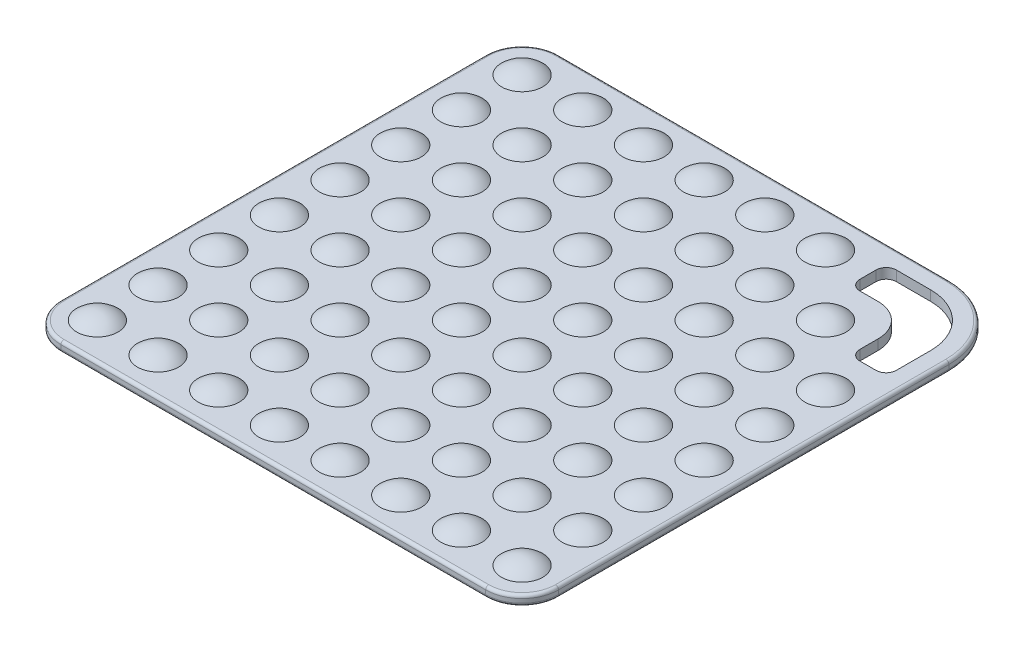
from build123d import *

# Parameters (mm, degrees)
BOSS_EXTRUDE1_DEPTH  = 5
LPATTERN1_COUNT      = 8
LPATTERN1_PITCH      = 30
LPATTERN1_COUNT_DIR2 = 8
LPATTERN1_PITCH_DIR2 = 30
FILLET1_R            = 1.5


with BuildPart() as part:
    # Sketch1 → Boss-Extrude1 (new body)
    with BuildSketch(Plane(origin=(0, 0, 0), x_dir=(1, 0, 0), z_dir=(0, 1, 0))):
        with BuildLine():
            Line((105, -123), (-105, -123))
            ThreePointArc((-105, -123), (-117.727922061, -117.727922061), (-123, -105))
            Line((-123, -105), (-123, 105))
            ThreePointArc((-123, 105), (-117.727922061, 117.727922061), (-105, 123))
            Line((-105, 123), (88, 123))
            ThreePointArc((88, 123), (112.748737342, 112.748737342), (123, 88))
            Line((123, 88), (123, -105))
            ThreePointArc((123, -105), (117.727922061, -117.727922061), (105, -123))
        make_face()
        with BuildLine():
            Line((71, 114), (88, 114))
            ThreePointArc((88, 114), (106.384776311, 106.384776311), (114, 88))
            Line((114, 88), (114, 71))
            ThreePointArc((114, 71), (112.535533906, 67.464466094), (109, 66))
            Line((109, 66), (101, 66))
            ThreePointArc((101, 66), (97.464466094, 67.464466094), (96, 71))
            Line((96, 71), (96, 80))
            ThreePointArc((96, 80), (91.313708499, 91.313708499), (80, 96))
            Line((80, 96), (71, 96))
            ThreePointArc((71, 96), (67.464466094, 97.464466094), (66, 101))
            Line((66, 101), (66, 109))
            ThreePointArc((66, 109), (67.464466094, 112.535533906), (71, 114))
        make_face(mode=Mode.SUBTRACT)
    extrude(amount=BOSS_EXTRUDE1_DEPTH)

    # Sketch4 → Revolve2 (revolve)
    with BuildSketch(Plane.XY.offset(105)):
        with BuildLine():
            Line((115.198039027, 5), (105, 5))
            Line((105, 5), (105, 9))
            ThreePointArc((105, 9), (110.477225575, 7.964240044), (115.198039027, 5))
        make_face()
    revolve2 = revolve(axis=Axis((105, 5, 105), (0, 1, 0)))

    # LPattern1: Revolve2 8 × 8, 3 skipped
    with Locations(*[(-j * LPATTERN1_PITCH_DIR2, 0, -i * LPATTERN1_PITCH) for i in range(LPATTERN1_COUNT) for j in range(LPATTERN1_COUNT_DIR2) if (i, j) not in ((0, 0), (6, 0), (7, 0), (7, 1))]):
        add(revolve2)

    # Fillet1
    fillet1_edges = [part.edges().sort_by_distance(p)[0] for p in [
        (0, 0, 123),
        (-117.727922061, 0, 117.727922061),
        (-123, 0, 0),
        (-117.727922061, 0, -117.727922061),
        (-117.727922061, 5, 117.727922061),
        (0, 5, 123),
        (117.727922061, 5, 117.727922061),
        (123, 5, 8.5),
        (112.748737342, 5, -112.748737342),
        (-8.5, 5, -123),
        (-117.727922061, 5, -117.727922061),
        (-8.5, 0, -123),
        (-123, 5, 0),
        (112.748737342, 0, -112.748737342),
        (123, 0, 8.5),
        (117.727922061, 0, 117.727922061),
    ]]
    fillet(fillet1_edges, radius=FILLET1_R)


solid = part.part
